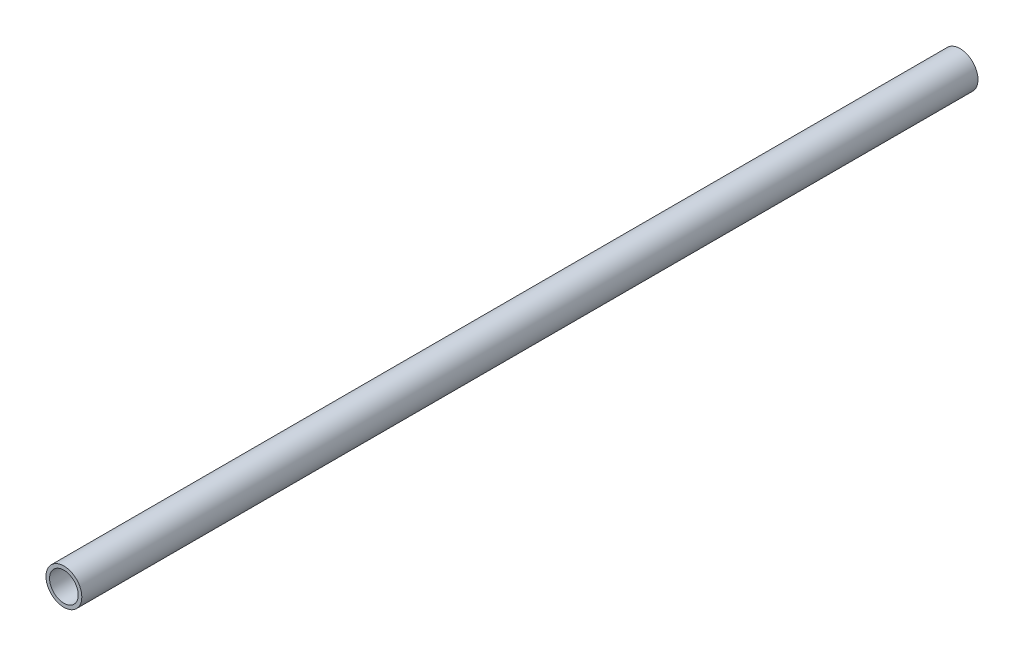
from build123d import *

# Parameters (mm, degrees)
SZKIC1_R                    = 5
SZKIC1_R_2                  = 4
DODANIE_WYCI_GNI_CIE1_DEPTH = 250


with BuildPart() as part:
    # Szkic1 → Dodanie-wyciągnięcie1 (new body)
    with BuildSketch(Plane.XY):
        Circle(SZKIC1_R)
        Circle(SZKIC1_R_2, mode=Mode.SUBTRACT)
    extrude(amount=DODANIE_WYCI_GNI_CIE1_DEPTH)


solid = part.part
